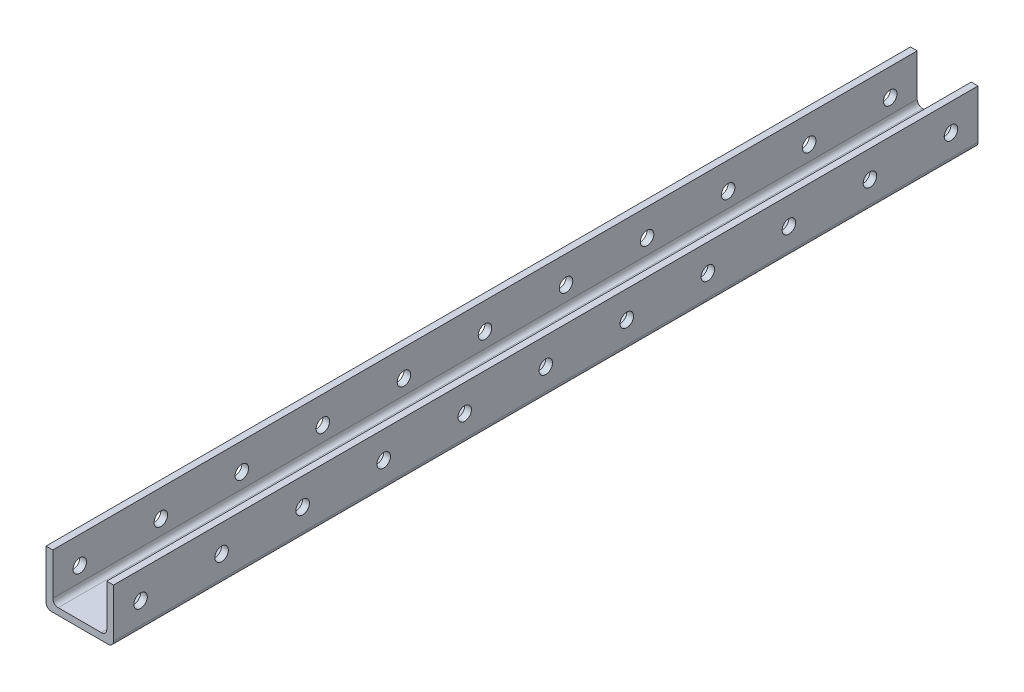
from build123d import *

# Parameters (mm, degrees)
SKETCH2_W           = 31.75
SKETCH2_H           = 406.4
BOSS_EXTRUDE1_DEPTH = 25.4
SKETCH3_W           = 25.4
SKETCH3_H           = 22.225
CUT_EXTRUDE1_DEPTH  = 406.4
FILLET1_R           = 2.54
FILLET3_R           = 2.54
SKETCH4_R           = 3.175
CUT_EXTRUDE2_DEPTH  = 50.8


with BuildPart() as part:
    # Sketch2 → Boss-Extrude1 (new body)
    with BuildSketch(Plane(origin=(0, 0, 0), x_dir=(1, 0, 0), z_dir=(0, 1, 0))):
        Rectangle(SKETCH2_W, SKETCH2_H)
    extrude(amount=BOSS_EXTRUDE1_DEPTH)

    # Sketch3 → Cut-Extrude1 (cut)
    with BuildSketch(Plane.XY.offset(203.2)):
        with Locations((0, 14.2875)):
            Rectangle(SKETCH3_W, SKETCH3_H)
    extrude(amount=-CUT_EXTRUDE1_DEPTH, mode=Mode.SUBTRACT)

    # Fillet1
    fillet1_edges = [part.edges().sort_by_distance(p)[0] for p in [
        (-15.875, 0, 0),
        (15.875, 0, 0),
    ]]
    fillet(fillet1_edges, radius=FILLET1_R)

    # Fillet3
    fillet3_edges = [part.edges().sort_by_distance(p)[0] for p in [
        (-12.7, 3.175, 0),
        (12.7, 3.175, 0),
    ]]
    fillet(fillet3_edges, radius=FILLET3_R)

    # Sketch4 → Cut-Extrude2 (cut)
    with BuildSketch(Plane(origin=(15.875, 0, 0), x_dir=(0, 0, -1), z_dir=(1, 0, 0))):
        with Locations((-190.5, 12.7)):
            Circle(SKETCH4_R)
        with Locations((-152.4, 12.7)):
            Circle(SKETCH4_R)
        with Locations((-114.3, 12.7)):
            Circle(SKETCH4_R)
        with Locations((-76.2, 12.7)):
            Circle(SKETCH4_R)
        with Locations((-38.1, 12.7)):
            Circle(SKETCH4_R)
        with Locations((0, 12.7)):
            Circle(SKETCH4_R)
        with Locations((38.1, 12.7)):
            Circle(SKETCH4_R)
        with Locations((76.2, 12.7)):
            Circle(SKETCH4_R)
        with Locations((114.3, 12.7)):
            Circle(SKETCH4_R)
        with Locations((152.4, 12.7)):
            Circle(SKETCH4_R)
        with Locations((190.5, 12.7)):
            Circle(SKETCH4_R)
    extrude(amount=-CUT_EXTRUDE2_DEPTH, mode=Mode.SUBTRACT)


solid = part.part
